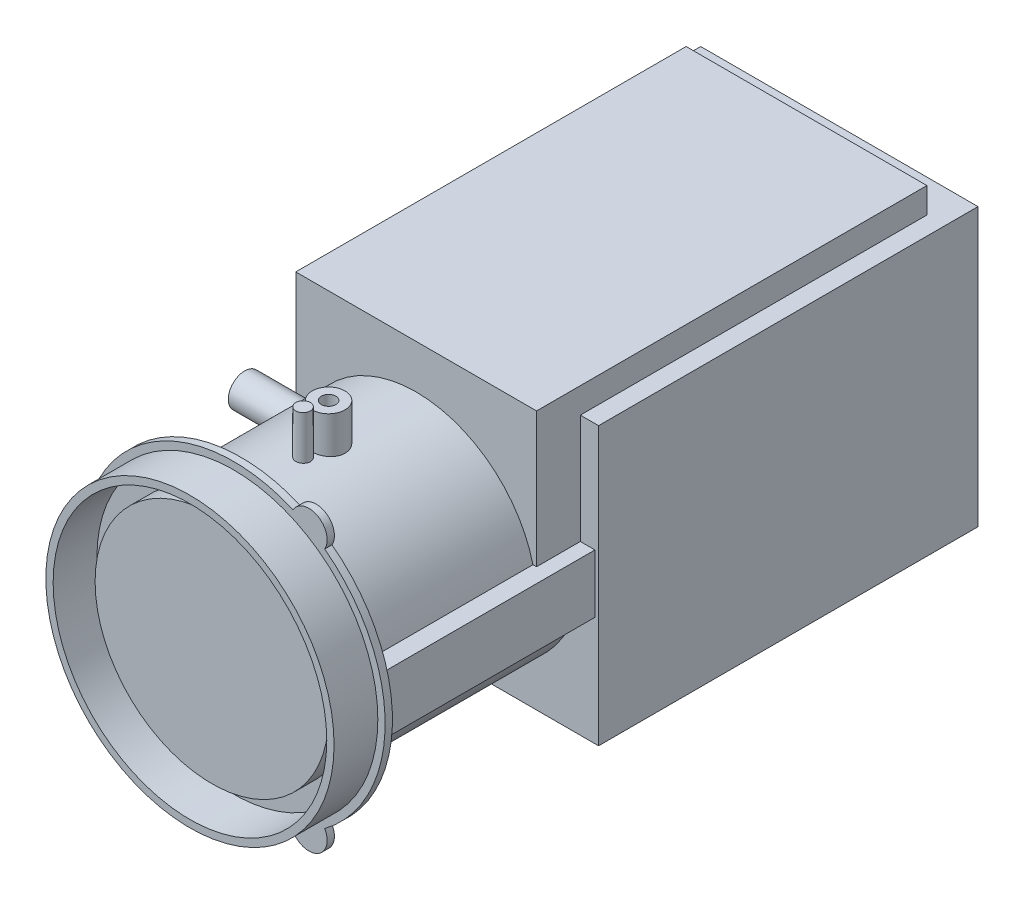
from build123d import *

# Parameters (mm, degrees)
SKETCH1_R                 = 19.75
SKETCH1_R_2               = 18.75
BOSS_EXTRUDE1_DEPTH       = 6
BOSS_EXTRUDE2_DEPTH       = 1
BOSS_EXTRUDE3_DEPTH       = 70
SKETCH4_R                 = 2.25
SKETCH4_R_2               = 1
BOSS_EXTRUDE4_DEPTH       = 21.5
SKETCH5_R                 = 1
BOSS_EXTRUDE5_DEPTH       = 22.5
SKETCH6_R                 = 2.25
SKETCH6_R_2               = 1
BOSS_EXTRUDE6_DEPTH       = 21.5
SKETCH7_R                 = 1
BOSS_EXTRUDE7_DEPTH       = 22.5
SKETCH8_R                 = 1
BOSS_EXTRUDE8_DEPTH       = 20
SKETCH9_R                 = 2.25
SKETCH9_R_2               = 1
BOSS_EXTRUDE9_DEPTH       = 18.5
SKETCH10_W                = 33
SKETCH10_H                = 53.5
BOSS_EXTRUDE10_DEPTH      = 22.5
BOSS_EXTRUDE11_DEPTH      = 12
BOSS_EXTRUDE11_DEPTH_BACK = 40
SKETCH11_W                = 38
SKETCH11_H                = 38
SKETCH12_R                = 16
BOSS_EXTRUDE12_DEPTH      = 3


with BuildPart() as part:
    # Sketch1 → Boss-Extrude1 (new body)
    with BuildSketch(Plane.XY):
        Circle(SKETCH1_R)
        Circle(SKETCH1_R_2, mode=Mode.SUBTRACT)
    extrude(amount=BOSS_EXTRUDE1_DEPTH)

    # Sketch2 → Boss-Extrude2 (add)
    with BuildSketch(Plane(origin=(0, 0, 0), x_dir=(-1, 0, 0), z_dir=(0, 0, -1))):
        with BuildLine():
            ThreePointArc((-12.464487037, 16.589124838), (-20.75, 0), (-12.464487037, -16.589124838))
            ThreePointArc((-12.464487037, -16.589124838), (-11.549423528, -20.004188348), (-8.134360018, -19.089124838))
            ThreePointArc((-8.134360018, -19.089124838), (10.375, -17.970027129), (20.598847055, -2.5))
            ThreePointArc((20.598847055, -2.5), (23.098847055, 0), (20.598847055, 2.5))
            ThreePointArc((20.598847055, 2.5), (10.375, 17.970027129), (-8.134360018, 19.089124838))
            ThreePointArc((-8.134360018, 19.089124838), (-11.549423528, 20.004188348), (-12.464487037, 16.589124838))
        make_face()
    extrude(amount=BOSS_EXTRUDE2_DEPTH)

    # Sketch3 → Boss-Extrude3 (add)
    with BuildSketch(Plane(origin=(0, 0, -1), x_dir=(-1, 0, 0), z_dir=(0, 0, -1))):
        with BuildLine():
            Line((16.007810594, 4), (18.5, 4))
            Line((18.5, 4), (18.5, -4))
            Line((18.5, -4), (16.007810594, -4))
            ThreePointArc((16.007810594, -4), (0, -16.5), (-16.007810594, -4))
            Line((-16.007810594, -4), (-18.5, -4))
            Line((-18.5, -4), (-18.5, 4))
            Line((-18.5, 4), (-16.007810594, 4))
            ThreePointArc((-16.007810594, 4), (0, 16.5), (16.007810594, 4))
        make_face()
    extrude(amount=BOSS_EXTRUDE3_DEPTH)

    # Sketch4 → Boss-Extrude4 (add, symmetric)
    with BuildSketch(Plane(origin=(0, 0, 0), x_dir=(1, 0, 0), z_dir=(0, 1, 0))):
        with Locations(Location((0, 13, 0), (0, 0, 90))):
            Circle(SKETCH4_R)
        with Locations(Location((0, 13, 0), (0, 0, 90))):
            Circle(SKETCH4_R_2, mode=Mode.SUBTRACT)
    extrude(amount=BOSS_EXTRUDE4_DEPTH, both=True)

    # Sketch5 → Boss-Extrude5 (add, symmetric)
    with BuildSketch(Plane(origin=(0, 0, 0), x_dir=(1, 0, 0), z_dir=(0, 1, 0))):
        with Locations(Location((0, 9.5, 0), (0, 0, 90))):
            Circle(SKETCH5_R)
    extrude(amount=BOSS_EXTRUDE5_DEPTH, both=True)

    # Sketch6 → Boss-Extrude6 (add)
    with BuildSketch(Plane(origin=(0, 0, 0), x_dir=(1, 0, 0), z_dir=(0, 1, 0))):
        with Locations(Location((3, 50.5, 0), (0, 0, 270))):
            Circle(SKETCH6_R)
        with Locations(Location((3, 50.5, 0), (0, 0, 270))):
            Circle(SKETCH6_R_2, mode=Mode.SUBTRACT)
    extrude(amount=-BOSS_EXTRUDE6_DEPTH)

    # Sketch7 → Boss-Extrude7 (add)
    with BuildSketch(Plane(origin=(0, 0, 0), x_dir=(1, 0, 0), z_dir=(0, 1, 0))):
        with Locations(Location((0.5, 54.5, 0), (0, 0, 270))):
            Circle(SKETCH7_R)
    extrude(amount=-BOSS_EXTRUDE7_DEPTH)

    # Sketch8 → Boss-Extrude8 (add)
    with BuildSketch(Plane(origin=(0, 0, 0), x_dir=(0, 0, -1), z_dir=(1, 0, 0))):
        with Locations((20, 0)):
            Circle(SKETCH8_R)
    extrude(amount=-BOSS_EXTRUDE8_DEPTH)

    # Sketch9 → Boss-Extrude9 (add)
    with BuildSketch(Plane(origin=(0, 0, 0), x_dir=(0, 0, -1), z_dir=(1, 0, 0))):
        with Locations((20, 10)):
            Circle(SKETCH9_R)
        with Locations((20, 10)):
            Circle(SKETCH9_R_2, mode=Mode.SUBTRACT)
    extrude(amount=-BOSS_EXTRUDE9_DEPTH)

    # Sketch10 → Boss-Extrude10 (add)
    with BuildSketch(Plane(origin=(0, 0, 0), x_dir=(1, 0, 0), z_dir=(0, 1, 0))):
        with Locations((0, 51.75)):
            Rectangle(SKETCH10_W, SKETCH10_H)
    extrude(amount=BOSS_EXTRUDE10_DEPTH)

    # Sketch11 → Boss-Extrude11 (add, two sides: drawn at the far end of the back side and taken through both)
    with BuildSketch(Plane(origin=(0, 0, -71), x_dir=(-1, 0, 0), z_dir=(0, 0, -1)).offset(-BOSS_EXTRUDE11_DEPTH_BACK)):
        Rectangle(SKETCH11_W, SKETCH11_H)
    extrude(amount=BOSS_EXTRUDE11_DEPTH + BOSS_EXTRUDE11_DEPTH_BACK)

    # Sketch12 → Boss-Extrude12 (add)
    with BuildSketch(Plane.XY):
        with Locations(Location((0, 0, 0), (0, 0, 180))):
            Circle(SKETCH12_R)
    extrude(amount=BOSS_EXTRUDE12_DEPTH)


solid = part.part
